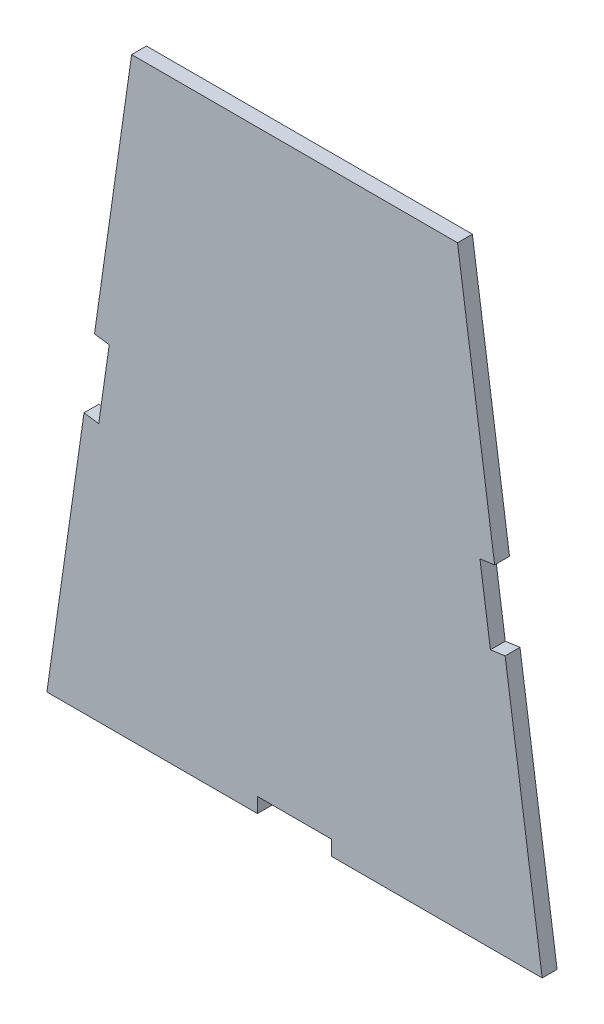
from build123d import *

# Parameters (mm, degrees)
BOSS_EXTRUDE1_DEPTH = 3


with BuildPart() as part:
    # Sketch2 → Boss-Extrude1 (new body)
    with BuildSketch(Plane.XY):
        Polygon((-142.12972749, -86.540150719), (-134.637599013, -33.965138982), (-131.667603708, -34.388374007), (-129.551428583, -19.53839748), (-132.521423888, -19.115162455), (-125.029295411, 33.459849281), (-59.230159569, 33.459849281), (-51.738031092, -19.115162455), (-54.708026397, -19.53839748), (-52.591851272, -34.388374007), (-49.621855967, -33.965138982), (-42.12972749, -86.540150719), (-84.62972749, -86.540150719), (-84.62972749, -83.540150719), (-99.62972749, -83.540150719), (-99.62972749, -86.540150719), align=None)
    extrude(amount=BOSS_EXTRUDE1_DEPTH)


solid = part.part
